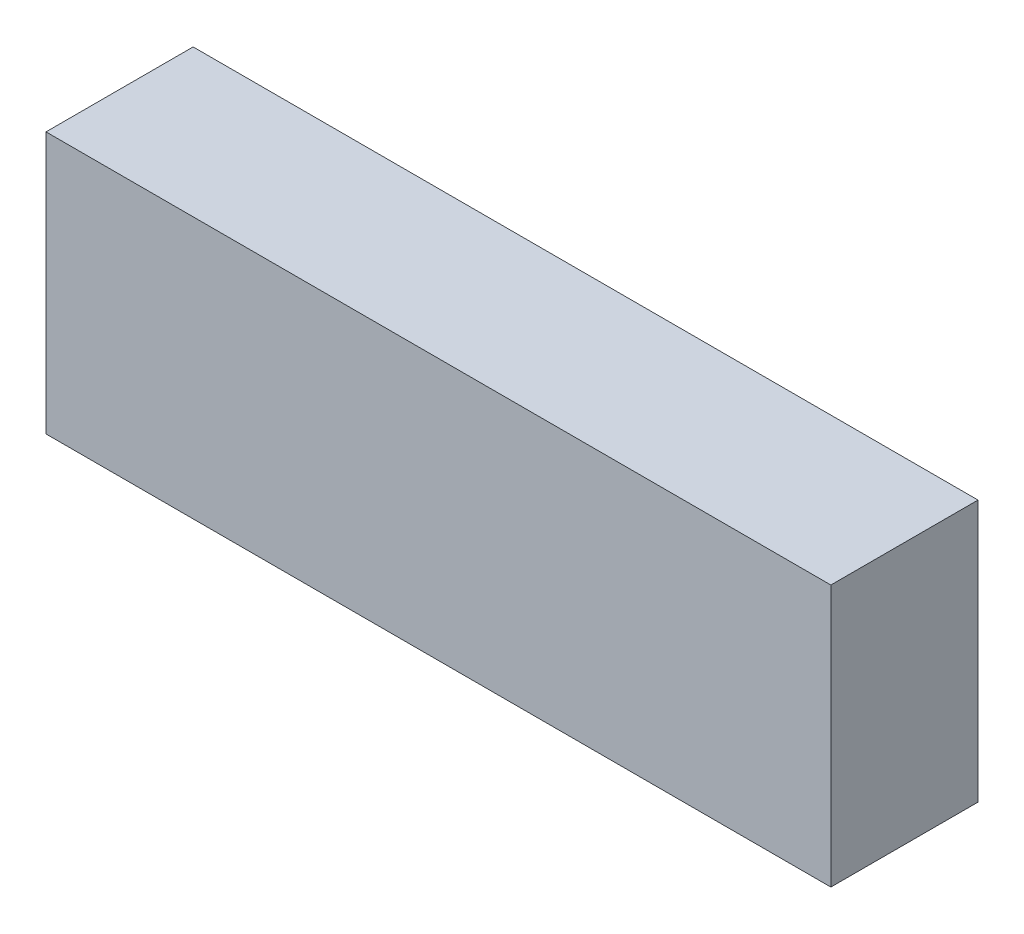
from build123d import *

# Parameters (mm, degrees)
SKIZZE1_W               = 5.334
SKIZZE1_H               = 1.778
COMPONENT_OUTLINE_DEPTH = 1


with BuildPart() as part:
    # Skizze1 → Component_Outline (new body)
    with BuildSketch(Plane.XY):
        with Locations((0.127, 0)):
            Rectangle(SKIZZE1_W, SKIZZE1_H)
    extrude(amount=COMPONENT_OUTLINE_DEPTH)


solid = part.part
